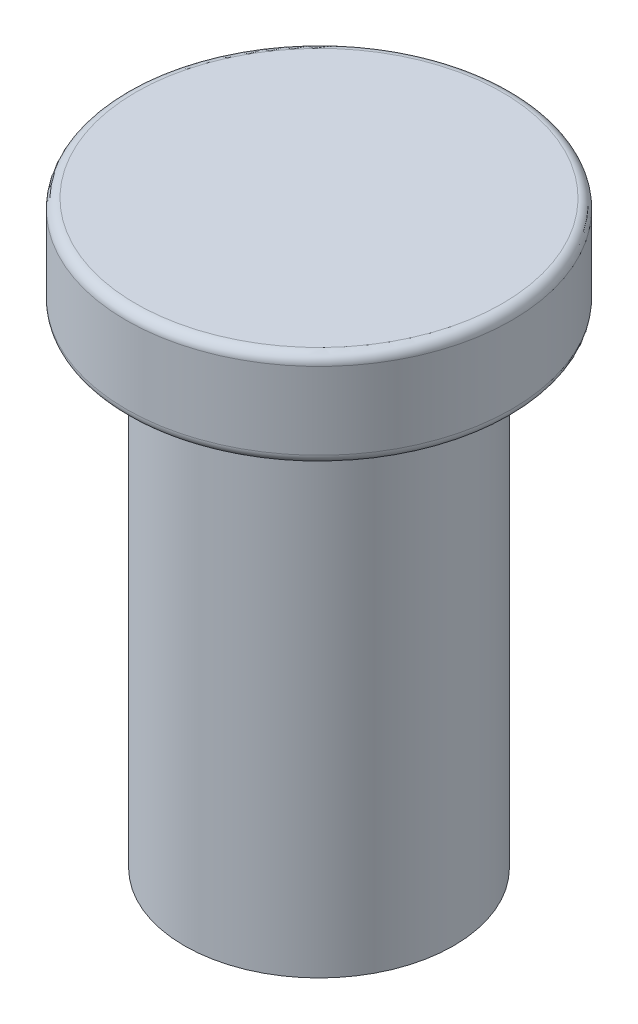
from build123d import *


with BuildPart() as part:
    # Esboço1 → Revolução1 (revolve)
    with BuildSketch(Plane.XY, mode=Mode.PRIVATE) as revolu_o1_sk:
        with BuildLine():
            Line((0, 12.07), (-3.81, 12.07))
            ThreePointArc((-3.81, 12.07), (-3.951421356, 12.011421356), (-4.01, 11.87))
            Line((-4.01, 11.87), (-4.01, 10.27))
            ThreePointArc((-4.01, 10.27), (-3.951421356, 10.128578644), (-3.81, 10.07))
            Line((-3.81, 10.07), (-2.8, 10.07))
            Line((-2.8, 10.07), (-2.8, 0))
            Line((-2.8, 0), (-2.57, 0))
            Line((-2.57, 0), (-2.57, 11.02))
            ThreePointArc((-2.57, 11.02), (-2.511421356, 11.161421356), (-2.37, 11.22))
            Line((-2.37, 11.22), (0, 11.22))
            Line((0, 11.22), (0, 12.07))
        make_face()
    revolve(revolu_o1_sk.sketch.rotate(Axis((0, 0, 0), (0, 1, 0)), 180), axis=Axis((0, 0, 0), (0, 1, 0)))


solid = part.part
